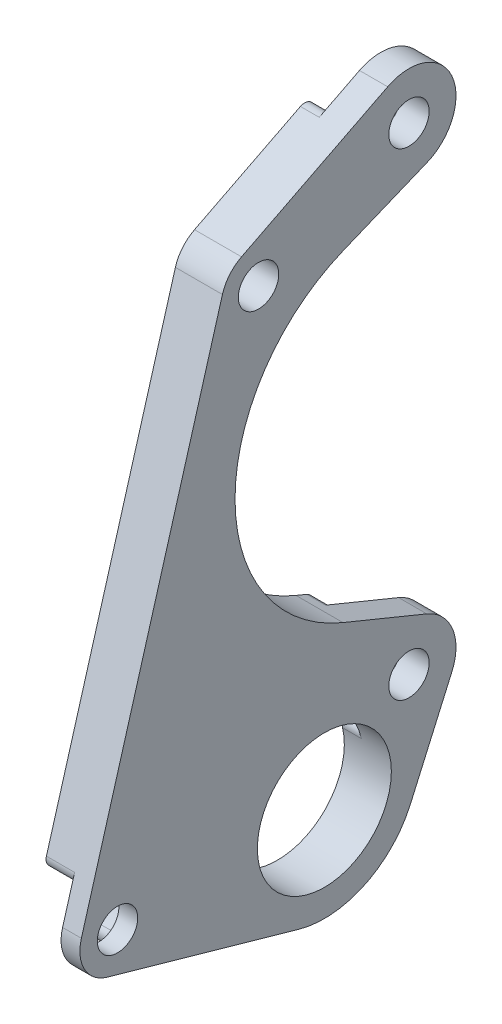
from build123d import *

# Parameters (mm, degrees)
SKETCH_1_R          = 2.15
SKETCH_1_R_2        = 7.125
EXTRUDE_1_DEPTH     = 5
SKETCH_2_R          = 4.5
CUT_EXTRUDE_1_DEPTH = 3
FILLET_1_R          = 1
CUT_EXTRUDE_2_DEPTH = 2
FILLET_2_R          = 1


with BuildPart() as part:
    # 草图1 → 凸台-拉伸1 (new body)
    with BuildSketch(Plane(origin=(0, 0, 0), x_dir=(0, 0, -1), z_dir=(1, 0, 0))):
        with BuildLine():
            Line((-23.090909091, -3.848365543), (-2.727272727, -9.620913858))
            ThreePointArc((-2.727272727, -9.620913858), (4.253098654, -9.050477989), (9.147283393, -4.040693817))
            Line((9.147283393, -4.040693817), (13.573641697, 5.979653091))
            ThreePointArc((13.573641697, 5.979653091), (13.638118854, 9.867579581), (10.897437667, 12.625984252))
            Line((10.897437667, 12.625984252), (1.979480632, 16.283858268))
            ThreePointArc((1.979480632, 16.283858268), (-9.5, 33.4), (1.979480632, 50.516141732))
            Line((1.979480632, 50.516141732), (10.897437667, 54.174015748))
            ThreePointArc((10.897437667, 54.174015748), (13.545928712, 60.881953925), (6.736898846, 63.258516924))
            Line((6.736898846, 63.258516924), (-8.810480924, 55.366813539))
            ThreePointArc((-8.810480924, 55.366813539), (-10.081211961, 54.350712224), (-10.842152772, 52.912592502))
            Line((-10.842152772, 52.912592502), (-25.842152772, 1.112592502))
            ThreePointArc((-25.842152772, 1.112592502), (-25.498078189, -1.939961078), (-23.090909091, -3.848365543))
        make_face()
        with Locations((9, 58.8)):
            Circle(SKETCH_1_R, mode=Mode.SUBTRACT)
        with Locations((-22, 0)):
            Circle(SKETCH_1_R, mode=Mode.SUBTRACT)
        with Locations((-7, 51.8)):
            Circle(SKETCH_1_R, mode=Mode.SUBTRACT)
        with Locations((9, 8)):
            Circle(SKETCH_1_R, mode=Mode.SUBTRACT)
        Circle(SKETCH_1_R_2, mode=Mode.SUBTRACT)
    extrude(amount=EXTRUDE_1_DEPTH)

    # 草图2 → 切除-拉伸1 (cut)
    with BuildSketch(Plane.ZY):
        with Locations((22, 0)):
            Circle(SKETCH_2_R)
    extrude(amount=-CUT_EXTRUDE_1_DEPTH, mode=Mode.SUBTRACT)

    # 圆角1
    fillet_1_edges = [part.edges().sort_by_distance(p)[0] for p in [
        (1.5, 3.092792715, 25.268735722),
        (1.5, -4.41060722, 21.107506888),
    ]]
    fillet(fillet_1_edges, radius=FILLET_1_R)

    # 草图3 → 切除-拉伸2 (cut)
    with BuildSketch(Plane.ZY):
        with BuildLine():
            Line((-3.75, 58.8), (-3.75, 51.242354784))
            Line((-3.75, 51.242354784), (-9.416400073, 53.566539292))
            ThreePointArc((-9.416400073, 53.566539292), (-12.562049945, 62.65672143), (-3.75, 58.8))
        make_face()
        with BuildLine():
            Line((-3.75, 8), (-3.75, 15.557645216))
            Line((-3.75, 15.557645216), (-9.416400073, 13.233460708))
            ThreePointArc((-9.416400073, 13.233460708), (-12.562049945, 4.14327857), (-3.75, 8))
        make_face()
    extrude(amount=-CUT_EXTRUDE_2_DEPTH, mode=Mode.SUBTRACT)

    # 圆角2
    fillet_2_edges = [part.edges().sort_by_distance(p)[0] for p in [
        (1, 5.693326891, -4.283883041),
        (1, 3.586845523, -6.156310924),
        (1, 62.533971032, -5.309476957),
        (1, 4.515373291, -12.926815084),
        (1, 15.557645216, -3.75),
        (1, 51.242354784, -3.75),
    ]]
    fillet(fillet_2_edges, radius=FILLET_2_R)


solid = part.part
